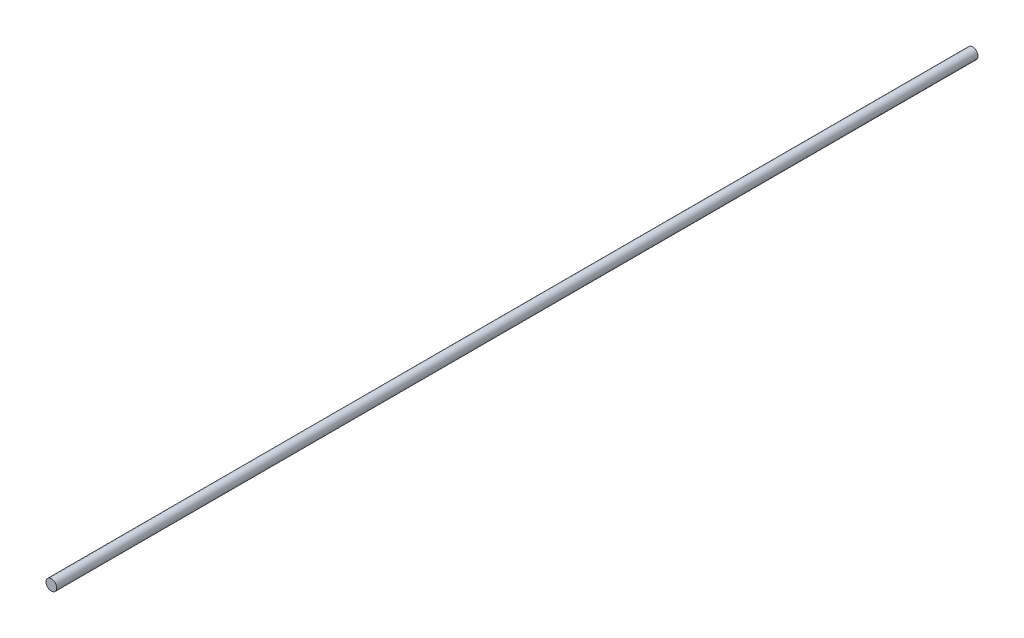
from build123d import *

# Parameters (mm, degrees)
BOSS_EXTRU_1_DEPTH      = 3
BOSS_EXTRU_1_DEPTH_BACK = 83
ESQUISSE1_R             = 0.5


with BuildPart() as part:
    # Esquisse1 → Boss.-Extru.1 (new, two sides: drawn at the far end of the back side and taken through both)
    with BuildSketch(Plane.XY.offset(-BOSS_EXTRU_1_DEPTH_BACK)):
        with Locations((0, 1)):
            Circle(ESQUISSE1_R)
    extrude(amount=BOSS_EXTRU_1_DEPTH + BOSS_EXTRU_1_DEPTH_BACK)


solid = part.part
